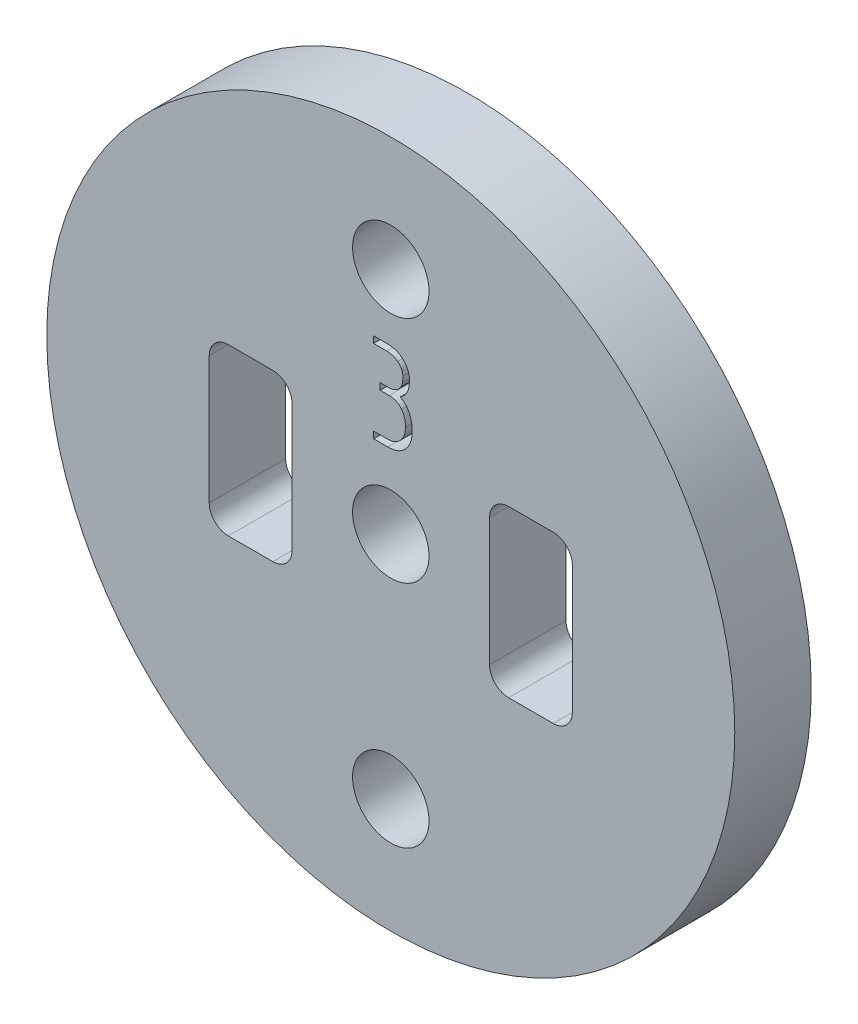
from build123d import *

# Parameters (mm, degrees)
MODEL_R                 = 13.5
MODEL_R_2               = 1.5
SALIENTE_EXTRUIR1_DEPTH = 3


with BuildPart() as part:
    # Model → Saliente-Extruir1 (new body)
    with BuildSketch(Plane.XY):
        with Locations((21.167864369, 283.836969837)):
            Circle(MODEL_R)
        with Locations((21.167864369, 283.836969837)):
            Circle(MODEL_R_2, mode=Mode.SUBTRACT)
        with Locations((21.167864369, 292.836969837)):
            Circle(MODEL_R_2, mode=Mode.SUBTRACT)
        with Locations((21.167864369, 274.836969837)):
            Circle(MODEL_R_2, mode=Mode.SUBTRACT)
        with BuildLine():
            Line((27.542864369, 287.086969837), (25.792864369, 287.086969837))
            ThreePointArc((25.792864369, 287.086969837), (25.262534283, 286.867299923), (25.042864369, 286.336969837))
            Line((25.042864369, 286.336969837), (25.042864369, 281.336969837))
            ThreePointArc((25.042864369, 281.336969837), (25.262534283, 280.806639751), (25.792864369, 280.586969837))
            Line((25.792864369, 280.586969837), (27.542864369, 280.586969837))
            ThreePointArc((27.542864369, 280.586969837), (28.073194454, 280.806639751), (28.292864369, 281.336969837))
            Line((28.292864369, 281.336969837), (28.292864369, 286.336969837))
            ThreePointArc((28.292864369, 286.336969837), (28.073194454, 286.867299923), (27.542864369, 287.086969837))
        make_face(mode=Mode.SUBTRACT)
        with BuildLine():
            Line((14.792864369, 287.086969837), (16.542864369, 287.086969837))
            ThreePointArc((16.542864369, 287.086969837), (17.073194454, 286.867299923), (17.292864369, 286.336969837))
            Line((17.292864369, 286.336969837), (17.292864369, 281.336969837))
            ThreePointArc((17.292864369, 281.336969837), (17.073194454, 280.806639751), (16.542864369, 280.586969837))
            Line((16.542864369, 280.586969837), (14.792864369, 280.586969837))
            ThreePointArc((14.792864369, 280.586969837), (14.262534283, 280.806639751), (14.042864369, 281.336969837))
            Line((14.042864369, 281.336969837), (14.042864369, 286.336969837))
            ThreePointArc((14.042864369, 286.336969837), (14.262534283, 286.867299923), (14.792864369, 287.086969837))
        make_face(mode=Mode.SUBTRACT)
        with BuildLine():
            add(Edge.make_bspline(
                [(22.006993441, 287.753415048), (22.006172191, 287.716928587), (22.004568422, 287.645676392), (21.993135393, 287.541332376), (21.973516379, 287.442536499), (21.946685696, 287.348686497), (21.911477525, 287.260048048), (21.868040261, 287.176817115), (21.817632611, 287.098498345), (21.777884433, 287.05133063), (21.758042881, 287.027785384)],
                knots=[0, 0, 0, 0, 1.115577891, 2.178544379, 3.204804607, 4.192155228, 5.159249624, 6.11554861, 7.059316894, 8, 8, 8, 8], degree=3))
            add(Edge.make_bspline(
                [(21.758042881, 287.027785384), (21.73601152, 287.004605717), (21.692200482, 286.958511187), (21.617136147, 286.900352518), (21.537624651, 286.849328876), (21.451173506, 286.810051796), (21.359873554, 286.77752931), (21.262438119, 286.754808132), (21.159003088, 286.741929369), (21.088224879, 286.739885485), (21.05200277, 286.738839488)],
                knots=[0, 0, 0, 0, 0.974182212, 1.937235425, 2.888233128, 3.849890637, 4.826332808, 5.840933291, 6.895056104, 8, 8, 8, 8], degree=3))
            Line((21.05200277, 286.738839488), (20.497781687, 286.738839488))
            Line((20.497781687, 286.738839488), (20.497781687, 287.000033518))
            Line((20.497781687, 287.000033518), (21.033229449, 287.000033518))
            add(Edge.make_bspline(
                [(21.033229449, 287.000033518), (21.059653725, 287.000919571), (21.111355614, 287.002653229), (21.186916697, 287.013225583), (21.258244632, 287.031310058), (21.32576964, 287.056003306), (21.38961335, 287.087000578), (21.44975153, 287.124774673), (21.505586643, 287.169810236), (21.538837792, 287.204528413), (21.555617508, 287.222048443)],
                knots=[0, 0, 0, 0, 1.084178992, 2.121310725, 3.122997411, 4.097638005, 5.066122913, 6.029254004, 7.005491271, 8, 8, 8, 8], degree=3))
            add(Edge.make_bspline(
                [(21.555617508, 287.222048443), (21.570999544, 287.239956661), (21.601490979, 287.275455687), (21.639704379, 287.334170151), (21.672756978, 287.395771039), (21.699752927, 287.461072065), (21.72000496, 287.530104828), (21.73464822, 287.60219141), (21.743868039, 287.677813713), (21.745145683, 287.72944549), (21.745799411, 287.755863742)],
                knots=[0, 0, 0, 0, 0.975929627, 1.934561601, 2.891539334, 3.86584409, 4.852559224, 5.863826262, 6.906991381, 8, 8, 8, 8], degree=3))
            add(Edge.make_bspline(
                [(21.745799411, 287.755863742), (21.745351061, 287.782273605), (21.744471049, 287.834110399), (21.736907633, 287.91019579), (21.725020702, 287.982561288), (21.707666875, 288.051045489), (21.685633293, 288.115780826), (21.65874604, 288.177014822), (21.627095592, 288.234661565), (21.601696729, 288.269786427), (21.589082993, 288.287230346)],
                knots=[0, 0, 0, 0, 1.12360389, 2.205389034, 3.250364499, 4.241620612, 5.208228378, 6.156918895, 7.084678002, 8, 8, 8, 8], degree=3))
            add(Edge.make_bspline(
                [(21.589082993, 288.287230346), (21.574544546, 288.305301748), (21.545751158, 288.341092151), (21.495588333, 288.387456001), (21.441330602, 288.427404284), (21.381961231, 288.458984195), (21.318660617, 288.484833389), (21.250329767, 288.502552092), (21.177508361, 288.513371193), (21.127407132, 288.514421779), (21.101792881, 288.514958891)],
                knots=[0, 0, 0, 0, 0.994376019, 1.96936123, 2.922417962, 3.87868906, 4.848062798, 5.850838393, 6.901241263, 8, 8, 8, 8], degree=3))
            Line((21.101792881, 288.514958891), (20.753262098, 288.514958891))
            Line((20.753262098, 288.514958891), (20.753262098, 288.776152921))
            Line((20.753262098, 288.776152921), (21.10097665, 288.776152921))
            add(Edge.make_bspline(
                [(21.10097665, 288.776152921), (21.124978156, 288.776894886), (21.17221513, 288.778355134), (21.24067129, 288.791069119), (21.305723418, 288.810446517), (21.365901811, 288.839327455), (21.422358121, 288.875571718), (21.473959727, 288.920548215), (21.522716334, 288.97252323), (21.549889744, 289.0127191), (21.563779822, 289.033265794)],
                knots=[0, 0, 0, 0, 1.03852652, 2.043907225, 3.00545783, 3.969963621, 4.924268074, 5.901926174, 6.927539546, 8, 8, 8, 8], degree=3))
            add(Edge.make_bspline(
                [(21.563779822, 289.033265794), (21.580087317, 289.061494287), (21.613384605, 289.119132341), (21.626478423, 289.184420887), (21.633159486, 289.217734078)],
                knots=[0, 0, 0, 0, 0.9795089, 2, 2, 2, 2], degree=3))
            add(Edge.make_bspline(
                [(21.633159486, 289.217734078), (21.634295276, 289.22888413), (21.637116527, 289.256580356), (21.640596563, 289.306371742), (21.640310959, 289.372553775), (21.640961043, 289.422066995), (21.641321799, 289.449543779)],
                knots=[0, 0, 0, 0, 0.579519237, 1.439499501, 2.579080104, 4, 4, 4, 4], degree=3))
            add(Edge.make_bspline(
                [(21.641321799, 289.449543779), (21.640763207, 289.468644592), (21.63967018, 289.506020185), (21.628999757, 289.560636767), (21.614177359, 289.613425933), (21.590523941, 289.663107736), (21.562151141, 289.711395656), (21.525289358, 289.755836224), (21.484208987, 289.79980254), (21.452048145, 289.825137537), (21.435631501, 289.838069899)],
                knots=[0, 0, 0, 0, 1.002526936, 1.961698665, 2.916276685, 3.87598114, 4.844591571, 5.851696512, 6.903388936, 8, 8, 8, 8], degree=3))
            add(Edge.make_bspline(
                [(21.435631501, 289.838069899), (21.404492029, 289.859708178), (21.342724342, 289.902629473), (21.237809785, 289.945182436), (21.126620474, 289.972764119), (21.049727634, 289.975992976), (21.010374971, 289.977645458)],
                knots=[0, 0, 0, 0, 0.996493568, 1.9766264, 2.964466133, 4, 4, 4, 4], degree=3))
            Line((21.010374971, 289.977645458), (20.492068068, 289.977645458))
            Line((20.492068068, 289.977645458), (20.492068068, 290.238839488))
            Line((20.492068068, 290.238839488), (21.00384512, 290.238839488))
            add(Edge.make_bspline(
                [(21.00384512, 290.238839488), (21.050463483, 290.237830417), (21.140687736, 290.235877481), (21.270239549, 290.213980608), (21.388857916, 290.180083596), (21.496796805, 290.132553021), (21.593313097, 290.070012259), (21.677888732, 289.992796138), (21.753031972, 289.903301888), (21.79148527, 289.834697752), (21.811097919, 289.799707025)],
                knots=[0, 0, 0, 0, 1.150398076, 2.226457596, 3.234476189, 4.191097105, 5.1286688, 6.061241881, 7.011159392, 8, 8, 8, 8], degree=3))
            add(Edge.make_bspline(
                [(21.811097919, 289.799707025), (21.82509514, 289.770872206), (21.852143494, 289.715151544), (21.880625138, 289.629637364), (21.898956697, 289.546912649), (21.901352998, 289.492346985), (21.902515829, 289.465868406)],
                knots=[0, 0, 0, 0, 1.100306842, 2.126242689, 3.090738963, 4, 4, 4, 4], degree=3))
            add(Edge.make_bspline(
                [(21.902515829, 289.465868406), (21.901891131, 289.42775605), (21.900702296, 289.355226154), (21.891776806, 289.251582475), (21.8771786, 289.158564557), (21.861121354, 289.101169298), (21.853541949, 289.074077361)],
                knots=[0, 0, 0, 0, 1.154078597, 2.19627467, 3.148598438, 4, 4, 4, 4], degree=3))
            add(Edge.make_bspline(
                [(21.853541949, 289.074077361), (21.838843028, 289.036134419), (21.809139523, 288.959459511), (21.738416217, 288.854815662), (21.647160825, 288.759558716), (21.574488619, 288.706503935), (21.536844187, 288.679021391)],
                knots=[0, 0, 0, 0, 0.944683212, 1.909011131, 2.91686117, 4, 4, 4, 4], degree=3))
            add(Edge.make_bspline(
                [(21.536844187, 288.679021391), (21.556380181, 288.670189844), (21.595409564, 288.65254601), (21.650160169, 288.618471642), (21.70215206, 288.57948108), (21.749595699, 288.532763352), (21.794728064, 288.480789053), (21.835328975, 288.421709647), (21.872110759, 288.356686798), (21.893827459, 288.310775319), (21.904964523, 288.287230346)],
                knots=[0, 0, 0, 0, 0.931933608, 1.861834807, 2.799465617, 3.75391061, 4.752908839, 5.790647278, 6.866968556, 8, 8, 8, 8], degree=3))
            add(Edge.make_bspline(
                [(21.904964523, 288.287230346), (21.920920296, 288.247015558), (21.953322712, 288.165348797), (21.98404343, 288.034618703), (22.003330483, 287.896567742), (22.00575246, 287.801914037), (22.006993441, 287.753415048)],
                knots=[0, 0, 0, 0, 0.947814742, 1.924788424, 2.936695996, 4, 4, 4, 4], degree=3))
        make_face(mode=Mode.SUBTRACT)
    extrude(amount=SALIENTE_EXTRUIR1_DEPTH)


solid = part.part
